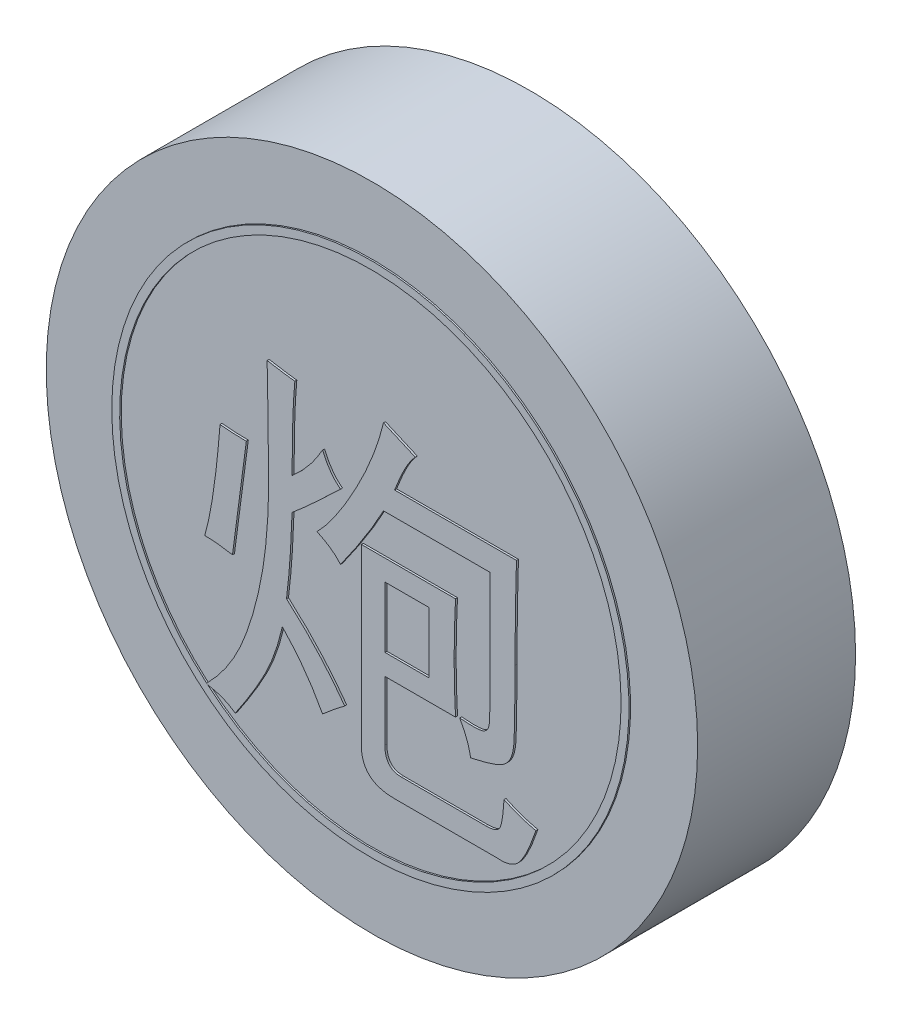
from build123d import *

# Parameters (mm, degrees)
SKETCH_1_R               = 16.5
DIAMETER33_HEIGHT8_DEPTH = 8
SKETCH_2_W               = 2.245614035
SKETCH_2_H               = 3.087719298
CHARACTER_DEPTH          = 0.1
SKETCH_3_R               = 13.1
SKETCH_3_R_2             = 12.7
INK_RING_DEPTH           = 0.08


with BuildPart() as part:
    # 草图1 → Diameter33_Height8 (new body)
    with BuildSketch(Plane.XY):
        Circle(SKETCH_1_R)
    extrude(amount=-DIAMETER33_HEIGHT8_DEPTH)

    # 草图2 → Character_炮 (add)
    # profile 1 of 4: a face of its own
    with BuildSketch(Plane.XY):
        with BuildLine():
            Line((-0.438596491, 0.412280702), (4.333333333, 0.412280702))
            add(Edge.make_bspline(
                [(4.333333333, 0.412280702), (4.32219403, 0.180991034), (4.300254935, -0.274538914), (4.280545765, -0.95042467), (4.266792277, -1.608022946), (4.264356298, -2.041253788), (4.263157895, -2.254385965)],
                knots=[0, 0, 0, 0, 1.041529255, 2.051314145, 3.04132481, 4, 4, 4, 4], degree=3))
            add(Edge.make_bspline(
                [(4.263157895, -2.254385965), (4.264340978, -2.456256151), (4.266737832, -2.865232575), (4.280700455, -3.488172277), (4.300139267, -4.128551913), (4.322178287, -4.561543263), (4.333333333, -4.780701754)],
                knots=[0, 0, 0, 0, 0.958414871, 1.941688842, 2.958186192, 4, 4, 4, 4], degree=3))
            Line((4.333333333, -4.780701754), (0.754385965, -4.780701754))
            Line((0.754385965, -4.780701754), (0.754385965, -7.798245614))
            add(Edge.make_bspline(
                [(0.754385965, -7.798245614), (0.756542025, -7.875517819), (0.760571778, -8.019942316), (0.79867763, -8.222584654), (0.866301083, -8.393546444), (0.958730485, -8.537425476), (1.080316095, -8.648955096), (1.230323038, -8.725821375), (1.404766808, -8.773219428), (1.530318809, -8.778119279), (1.596491228, -8.780701754)],
                knots=[0, 0, 0, 0, 1.252760199, 2.341453324, 3.325319473, 4.217929197, 5.093335219, 5.967160472, 6.92858809, 8, 8, 8, 8], degree=3))
            Line((1.596491228, -8.780701754), (5.877192982, -8.780701754))
            add(Edge.make_bspline(
                [(5.877192982, -8.780701754), (5.952676442, -8.778505643), (6.091865118, -8.774456097), (6.282983042, -8.738694541), (6.432873953, -8.670057218), (6.535011145, -8.590100361), (6.590568401, -8.495587019), (6.627825926, -8.39523744), (6.663290389, -8.264597524), (6.696736899, -8.104116088), (6.724132709, -7.913000321), (6.749792718, -7.691981988), (6.773714936, -7.439888276), (6.7840244, -7.261145122), (6.789473684, -7.166666667)],
                knots=[0, 0, 0, 0, 1.261361218, 2.325902893, 3.219579981, 3.999862689, 4.441750613, 5.033083926, 5.784644729, 6.701580166, 7.770148816, 9.008968199, 10.419027196, 12, 12, 12, 12], degree=3))
            add(Edge.make_bspline(
                [(6.789473684, -7.166666667), (6.910015047, -7.223861616), (7.156211115, -7.340677714), (7.549073328, -7.486623437), (7.965883604, -7.620225519), (8.255749653, -7.691657664), (8.403508772, -7.728070175)],
                knots=[0, 0, 0, 0, 0.93451649, 1.908675008, 2.933947809, 4, 4, 4, 4], degree=3))
            add(Edge.make_bspline(
                [(8.403508772, -7.728070175), (8.36949527, -7.8296605), (8.304058566, -8.02510453), (8.198937234, -8.304643175), (8.096064707, -8.560417297), (7.994786169, -8.791899572), (7.89604981, -9.000063782), (7.795682505, -9.182852475), (7.696450007, -9.34228243), (7.600201862, -9.48077287), (7.497384712, -9.598754284), (7.381771504, -9.696234518), (7.252832947, -9.773671097), (7.11391136, -9.837679917), (6.961465129, -9.881457369), (6.797357236, -9.906967442), (6.621323268, -9.914310156), (6.5009461, -9.907194395), (6.438596491, -9.903508772)],
                knots=[0, 0, 0, 0, 1.59358626, 3.065812832, 4.441936642, 5.694264479, 6.824081133, 7.868089909, 8.794324934, 9.616838825, 10.374605891, 11.115526659, 11.855998927, 12.605833349, 13.384785664, 14.20689557, 15.071257761, 16, 16, 16, 16], degree=3))
            Line((6.438596491, -9.903508772), (1.245614035, -9.903508772))
            add(Edge.make_bspline(
                [(1.245614035, -9.903508772), (1.118729026, -9.900633054), (0.879350959, -9.895207796), (0.544624652, -9.825850562), (0.255101887, -9.719457547), (0.014016726, -9.562552167), (-0.1791111, -9.360389951), (-0.317167852, -9.111164898), (-0.411189016, -8.820725067), (-0.429127218, -8.610810398), (-0.438596491, -8.5)],
                knots=[0, 0, 0, 0, 1.225516294, 2.31202822, 3.291071766, 4.193033827, 5.070480065, 5.96763954, 6.927151342, 8, 8, 8, 8], degree=3))
            Line((-0.438596491, -8.5), (-0.438596491, 0.412280702))
        make_face()
        with Locations((1.877192982, -2.184210526)):
            Rectangle(SKETCH_2_W, SKETCH_2_H, mode=Mode.SUBTRACT)
    # profile 2 of 4: a face of its own
    with BuildSketch(Plane.XY):
        with BuildLine():
            add(Edge.make_bspline(
                [(-2.684210526, -0.149122807), (-2.607244312, -0.068348187), (-2.447615588, 0.099179209), (-2.21396229, 0.373003608), (-1.976662273, 0.677888972), (-1.740262061, 1.015456733), (-1.496502959, 1.381351566), (-1.25047895, 1.778427942), (-1.001886572, 2.207139891), (-0.669003024, 2.811251328), (-0.279105655, 3.577593039), (0.117693311, 4.500779683), (0.447568877, 5.404475152), (0.606392816, 6.01022371), (0.684210526, 6.307017544)],
                knots=[0, 0, 0, 0, 0.546400256, 1.133239775, 1.762215174, 2.43802967, 3.15124418, 3.915465038, 4.725518671, 5.57828231, 7.293836538, 8.934212293, 10.497880223, 12, 12, 12, 12], degree=3))
            add(Edge.make_bspline(
                [(0.684210526, 6.307017544), (0.947152723, 6.18906458), (1.482461117, 5.94893115), (2.023144572, 5.721155803), (2.298245614, 5.605263158)],
                knots=[0, 0, 0, 0, 0.982395191, 2, 2, 2, 2], degree=3))
            add(Edge.make_bspline(
                [(2.298245614, 5.605263158), (2.255609317, 5.560222478), (2.164793229, 5.464285009), (2.042158849, 5.291394232), (1.912161769, 5.092979346), (1.781901862, 4.861646679), (1.651209689, 4.599719254), (1.514938612, 4.308440709), (1.381167425, 3.98465958), (1.292053844, 3.758309052), (1.245614035, 3.640350877)],
                knots=[0, 0, 0, 0, 0.663045856, 1.41229974, 2.263621425, 3.202134772, 4.251301671, 5.396319134, 6.643142355, 8, 8, 8, 8], degree=3))
            Line((1.245614035, 3.640350877), (7.421052632, 3.640350877))
            add(Edge.make_bspline(
                [(7.421052632, 3.640350877), (7.415876542, 3.488737431), (7.405110744, 3.173395178), (7.387896511, 2.682247334), (7.379737007, 2.155395839), (7.368115328, 1.594031729), (7.360518712, 0.997957252), (7.356408994, 0.366362277), (7.349378547, -0.300723767), (7.350369501, -0.757307943), (7.350877193, -0.99122807)],
                knots=[0, 0, 0, 0, 0.785958954, 1.634723531, 2.546077398, 3.515771858, 4.543739525, 5.634495728, 6.788089711, 8, 8, 8, 8], degree=3))
            add(Edge.make_bspline(
                [(7.350877193, -0.99122807), (7.351424886, -1.219950248), (7.352464276, -1.654009873), (7.345521867, -2.271714228), (7.341378496, -2.821004426), (7.33420145, -3.302742426), (7.322371891, -3.715929733), (7.315071359, -4.060968483), (7.29756022, -4.338068723), (7.280860397, -4.610606831), (7.237056435, -4.886898815), (7.145088227, -5.171911876), (7.008842414, -5.408615837), (6.857359521, -5.570077576), (6.705782828, -5.673210663), (6.565047823, -5.751034402), (6.393887751, -5.825468616), (6.193851241, -5.90115993), (5.963012143, -5.971642882), (5.704111538, -6.045155197), (5.415740714, -6.118273014), (5.211990817, -6.161544294), (5.105263158, -6.184210526)],
                knots=[0, 0, 0, 0, 2.093243972, 3.972473083, 5.653486224, 7.120535649, 8.381638283, 9.436666045, 10.278480565, 10.922485454, 11.93531434, 12.830443783, 13.647741699, 14.416032427, 14.831754699, 15.321556192, 15.885906174, 16.538300622, 17.278076745, 18.093834768, 19.001518255, 20, 20, 20, 20], degree=3))
            add(Edge.make_bspline(
                [(5.105263158, -6.184210526), (5.078216399, -6.056228209), (5.024186518, -5.800564701), (4.899318544, -5.426672951), (4.741288892, -5.061098719), (4.610094194, -4.82813809), (4.543859649, -4.710526316)],
                knots=[0, 0, 0, 0, 0.989663112, 1.976997679, 2.978673384, 4, 4, 4, 4], degree=3))
            add(Edge.make_bspline(
                [(4.543859649, -4.710526316), (4.653806836, -4.720420658), (4.86131355, -4.739094556), (5.152924836, -4.746823134), (5.405672395, -4.739686335), (5.620537146, -4.71990692), (5.804708808, -4.661399495), (5.941922153, -4.53663161), (6.025729221, -4.358559853), (6.052094978, -4.17615843), (6.05940974, -3.998418574), (6.067697643, -3.825993092), (6.075711226, -3.621566765), (6.080676164, -3.384144914), (6.082516701, -3.113818373), (6.085168767, -2.809726014), (6.088456449, -2.472715567), (6.087972135, -2.237059616), (6.087719298, -2.114035088)],
                knots=[0, 0, 0, 0, 1.363132991, 2.572682894, 3.600404617, 4.484322373, 5.235778938, 5.94045101, 6.706095796, 7.619131718, 8.197834119, 8.90477724, 9.750703209, 10.724657567, 11.837530972, 13.089501406, 14.480570013, 16, 16, 16, 16], degree=3))
            Line((6.087719298, -2.114035088), (6.087719298, 2.447368421))
            Line((6.087719298, 2.447368421), (0.684210526, 2.447368421))
            add(Edge.make_bspline(
                [(0.684210526, 2.447368421), (0.617441899, 2.321297964), (0.480556448, 2.062835086), (0.253981586, 1.673347978), (0.014715029, 1.264967833), (-0.250580666, 0.844350635), (-0.52913706, 0.404851477), (-0.832037599, -0.047442621), (-1.154213023, -0.51480816), (-1.377401323, -0.830317366), (-1.49122807, -0.99122807)],
                knots=[0, 0, 0, 0, 0.84073928, 1.723638498, 2.655419099, 3.63023716, 4.65436133, 5.722196596, 6.838312978, 8, 8, 8, 8], degree=3))
            add(Edge.make_bspline(
                [(-1.49122807, -0.99122807), (-1.566343917, -0.910276075), (-1.722102624, -0.742415646), (-2.003289621, -0.524505592), (-2.325910913, -0.322393255), (-2.561691535, -0.208371882), (-2.684210526, -0.149122807)],
                knots=[0, 0, 0, 0, 0.899510514, 1.865206902, 2.890694684, 4, 4, 4, 4], degree=3))
        make_face()
    # profile 3 of 4: a face of its own
    with BuildSketch(Plane.XY):
        with BuildLine():
            add(Edge.make_bspline(
                [(-8.298245614, -9.622807018), (-8.201263048, -9.522204954), (-8.008394753, -9.322138599), (-7.734940037, -9.009978), (-7.479914369, -8.687288297), (-7.242878701, -8.354300999), (-7.024606013, -8.010061232), (-6.822013667, -7.657383687), (-6.636355534, -7.295200516), (-6.413642512, -6.792856233), (-6.163605748, -6.135128614), (-5.901463294, -5.306022697), (-5.673248955, -4.429872143), (-5.480712448, -3.503655797), (-5.326224679, -2.522896188), (-5.220414285, -1.48170751), (-5.14998176, -0.379682326), (-5.143615389, 0.375777463), (-5.140350877, 0.763157895)],
                knots=[0, 0, 0, 0, 0.602569032, 1.198323232, 1.788840836, 2.375623389, 2.960201216, 3.545971817, 4.129139034, 4.714492441, 5.914900985, 7.161517809, 8.462856384, 9.817737407, 11.239759603, 12.742477888, 14.329626092, 16, 16, 16, 16], degree=3))
            add(Edge.make_bspline(
                [(-5.140350877, 0.763157895), (-5.141563897, 1.17295122), (-5.144056667, 2.015081344), (-5.158055547, 3.313770546), (-5.177687899, 4.681815462), (-5.199405465, 5.617406085), (-5.210526316, 6.096491228)],
                knots=[0, 0, 0, 0, 0.921936609, 1.894590625, 2.921889202, 4, 4, 4, 4], degree=3))
            add(Edge.make_bspline(
                [(-5.210526316, 6.096491228), (-5.084971362, 6.074420647), (-4.839330424, 6.031240844), (-4.479601128, 5.975103703), (-4.137722159, 5.923713282), (-3.915394745, 5.898335658), (-3.807017544, 5.885964912)],
                knots=[0, 0, 0, 0, 1.077673639, 2.108405575, 3.077910785, 4, 4, 4, 4], degree=3))
            add(Edge.make_bspline(
                [(-3.807017544, 5.885964912), (-3.818839372, 5.756921542), (-3.843731891, 5.485202604), (-3.87117703, 5.057051788), (-3.8945594, 4.590035768), (-3.9120307, 4.08311975), (-3.927157054, 3.537294876), (-3.941755979, 2.951664283), (-3.94499699, 2.326945542), (-3.946561132, 1.897226277), (-3.947368421, 1.675438596)],
                knots=[0, 0, 0, 0, 0.737944263, 1.553845279, 2.443057176, 3.400857167, 4.442331426, 5.552733575, 6.736911306, 8, 8, 8, 8], degree=3))
            add(Edge.make_bspline(
                [(-3.947368421, 1.675438596), (-3.798037625, 1.808527791), (-3.497852886, 2.076063666), (-3.097532911, 2.534141521), (-2.722544889, 3.027833407), (-2.510884254, 3.387643638), (-2.403508772, 3.570175439)],
                knots=[0, 0, 0, 0, 0.976260685, 1.962479047, 2.966365221, 4, 4, 4, 4], degree=3))
            add(Edge.make_bspline(
                [(-2.403508772, 3.570175439), (-2.343353726, 3.436861804), (-2.228064192, 3.18136093), (-2.011459923, 2.836759352), (-1.772615912, 2.539643501), (-1.583208762, 2.383058841), (-1.49122807, 2.307017544)],
                knots=[0, 0, 0, 0, 1.112664531, 2.132465744, 3.093080206, 4, 4, 4, 4], degree=3))
            add(Edge.make_bspline(
                [(-1.49122807, 2.307017544), (-1.622185943, 2.183272357), (-1.875632764, 1.943784469), (-2.240464786, 1.594583317), (-2.584384567, 1.274895669), (-2.903795613, 0.981832012), (-3.197702025, 0.713399688), (-3.466950405, 0.47130542), (-3.715247534, 0.257992547), (-3.872791281, 0.124564772), (-3.947368421, 0.061403509)],
                knots=[0, 0, 0, 0, 1.299128935, 2.514244397, 3.641324308, 4.684712061, 5.63984292, 6.511381073, 7.295326248, 8, 8, 8, 8], degree=3))
            add(Edge.make_bspline(
                [(-3.947368421, 0.061403509), (-3.96085549, -0.300790054), (-3.987002005, -1.002951508), (-4.045222676, -2.020518963), (-4.125234803, -2.968585477), (-4.194621288, -3.575734804), (-4.228070175, -3.868421053)],
                knots=[0, 0, 0, 0, 1.103554606, 2.13939061, 3.103062858, 4, 4, 4, 4], degree=3))
            add(Edge.make_bspline(
                [(-4.228070175, -3.868421053), (-3.952935381, -4.116436024), (-3.405575654, -4.609842928), (-2.643782001, -5.4032241), (-1.928582474, -6.226565922), (-1.49636276, -6.806917915), (-1.280701754, -7.096491228)],
                knots=[0, 0, 0, 0, 1.014484449, 2.018239572, 3.011177804, 4, 4, 4, 4], degree=3))
            add(Edge.make_bspline(
                [(-1.280701754, -7.096491228), (-1.469173857, -7.241259475), (-1.851750676, -7.535122463), (-2.217793014, -7.849346684), (-2.403508772, -8.00877193)],
                knots=[0, 0, 0, 0, 0.98527717, 2, 2, 2, 2], degree=3))
            add(Edge.make_bspline(
                [(-2.403508772, -8.00877193), (-2.538497471, -7.764008873), (-2.811638587, -7.268746273), (-3.293770693, -6.55785765), (-3.835128902, -5.863335742), (-4.235469285, -5.424442687), (-4.438596491, -5.201754386)],
                knots=[0, 0, 0, 0, 0.964095333, 1.950786066, 2.960257024, 4, 4, 4, 4], degree=3))
            add(Edge.make_bspline(
                [(-4.438596491, -5.201754386), (-4.49920244, -5.452249445), (-4.617494307, -5.941170564), (-4.849661513, -6.641551746), (-5.108325764, -7.297020352), (-5.515736792, -8.101792781), (-6.079066858, -9.067269108), (-6.574665505, -9.809802583), (-6.824561404, -10.184210526)],
                knots=[0, 0, 0, 0, 0.833641504, 1.627117669, 2.385635067, 3.111574229, 4.543567946, 6, 6, 6, 6], degree=3))
            add(Edge.make_bspline(
                [(-6.824561404, -10.184210526), (-6.923292445, -10.117017015), (-7.127669973, -9.977923538), (-7.480094506, -9.823564039), (-7.873238056, -9.699691727), (-8.152811717, -9.649116298), (-8.298245614, -9.622807018)],
                knots=[0, 0, 0, 0, 0.898656135, 1.860257086, 2.886908194, 4, 4, 4, 4], degree=3))
        make_face()
    # profile 4 of 4: a face of its own
    with BuildSketch(Plane.XY):
        with BuildLine():
            add(Edge.make_bspline(
                [(-6.263157895, 2.026315789), (-6.297796695, 1.757741086), (-6.365287402, 1.234446498), (-6.464215053, 0.469468601), (-6.55793518, -0.255658116), (-6.645735983, -0.942003606), (-6.730984508, -1.589254142), (-6.816100576, -2.196945166), (-6.889305096, -2.765806117), (-6.940348773, -3.131187016), (-6.964912281, -3.307017544)],
                knots=[0, 0, 0, 0, 1.208176354, 2.354027158, 3.441385877, 4.470252566, 5.441127555, 6.354025658, 7.207915526, 8, 8, 8, 8], degree=3))
            add(Edge.make_bspline(
                [(-6.964912281, -3.307017544), (-7.090365666, -3.285107458), (-7.334503846, -3.242469403), (-7.694451705, -3.198667195), (-8.037025851, -3.170995275), (-8.260076685, -3.168081836), (-8.368421053, -3.166666667)],
                knots=[0, 0, 0, 0, 1.081815404, 2.105263584, 3.079653667, 4, 4, 4, 4], degree=3))
            add(Edge.make_bspline(
                [(-8.368421053, -3.166666667), (-8.327101644, -3.017149112), (-8.239240029, -2.699214896), (-8.131491073, -2.187371787), (-8.024897509, -1.61804539), (-7.923294159, -0.989881086), (-7.830803244, -0.302518286), (-7.746218702, 0.444626132), (-7.664615975, 1.250260876), (-7.619723884, 1.807900384), (-7.596491228, 2.096491228)],
                knots=[0, 0, 0, 0, 0.698704299, 1.485725231, 2.355362038, 3.308254067, 4.352084769, 5.47966451, 6.695670343, 8, 8, 8, 8], degree=3))
            add(Edge.make_bspline(
                [(-7.596491228, 2.096491228), (-7.498672058, 2.085207538), (-7.294748788, 2.06168447), (-6.973764522, 2.042963685), (-6.627145963, 2.029535847), (-6.387063524, 2.027411933), (-6.263157895, 2.026315789)],
                knots=[0, 0, 0, 0, 0.884317725, 1.843533967, 2.887056125, 4, 4, 4, 4], degree=3))
        make_face()
    extrude(amount=CHARACTER_DEPTH)

    # 草图3 → Ink_ring (add)
    with BuildSketch(Plane.XY):
        with Locations(Location((0, 0, 0), (0, 0, 180))):
            Circle(SKETCH_3_R)
        Circle(SKETCH_3_R_2, mode=Mode.SUBTRACT)
    extrude(amount=INK_RING_DEPTH)


solid = part.part
